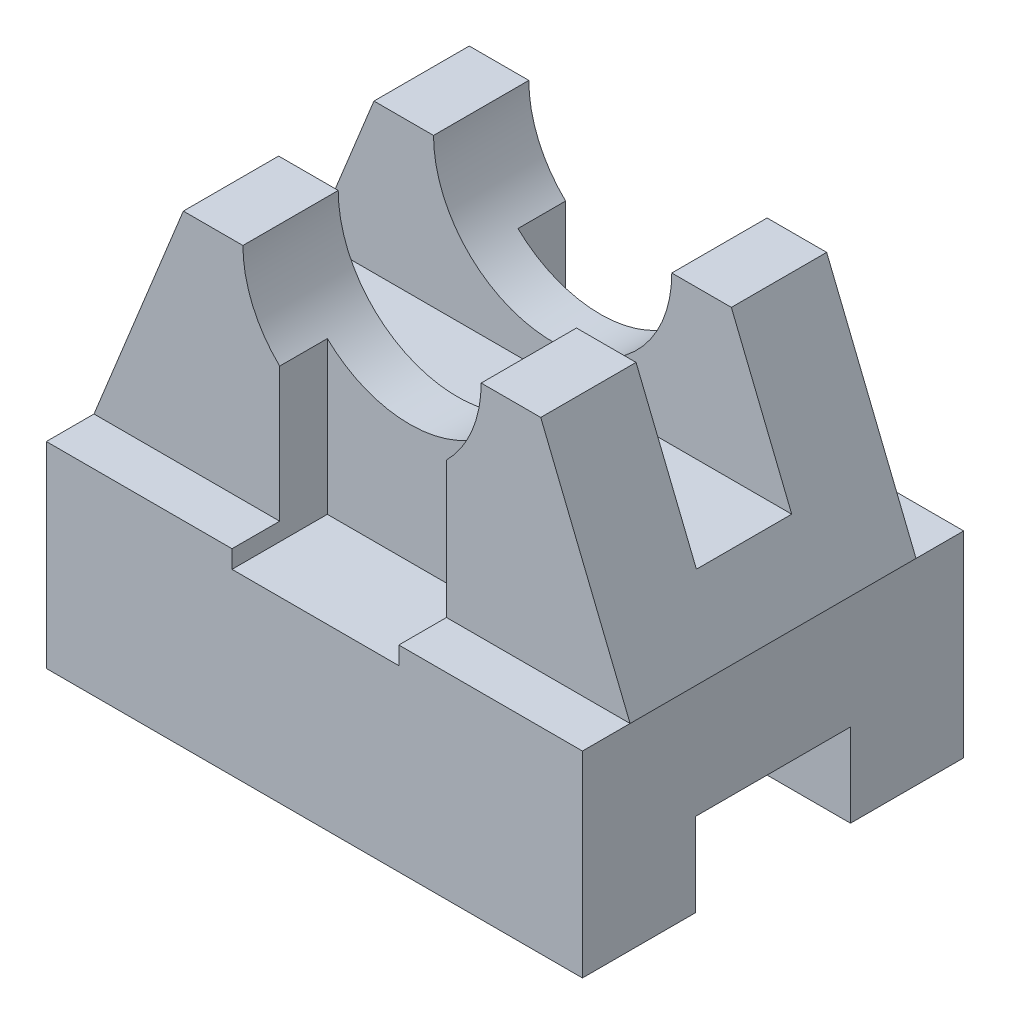
from build123d import *

# Parameters (mm, degrees)
SKETCH1_W           = 90
SKETCH1_H           = 64
BOSS_EXTRUDE1_DEPTH = 33
SKETCH2_W           = 26
SKETCH2_H           = 14
CUT_EXTRUDE1_DEPTH  = 102.05938848
BOSS_EXTRUDE2_DEPTH = 24
SKETCH4_W           = 86.893013234
SKETCH4_H           = 16
CUT_EXTRUDE2_DEPTH  = 25
SKETCH6_W           = 28
SKETCH6_H           = 16
CUT_EXTRUDE3_DEPTH  = 40


with BuildPart() as part:
    # Sketch1 → Boss-Extrude1 (new body)
    with BuildSketch(Plane(origin=(0, 0, 0), x_dir=(1, 0, 0), z_dir=(0, 1, 0))):
        Rectangle(SKETCH1_W, SKETCH1_H)
    extrude(amount=BOSS_EXTRUDE1_DEPTH)

    # Sketch2 → Cut-Extrude1 (cut, through all)
    with BuildSketch(Plane(origin=(45, 0, 0), x_dir=(0, 0, -1), z_dir=(1, 0, 0))):
        with Locations((0, 7)):
            Rectangle(SKETCH2_W, SKETCH2_H)
    extrude(amount=-CUT_EXTRUDE1_DEPTH, mode=Mode.SUBTRACT)

    # Sketch3 → Boss-Extrude2 (add, symmetric)
    with BuildSketch(Plane.XY):
        with BuildLine():
            Line((0, 50), (0, 33))
            Line((0, 33), (45, 33))
            Line((45, 33), (30, 70))
            Line((30, 70), (20, 70))
            ThreePointArc((20, 70), (14.142135624, 55.857864376), (0, 50))
        make_face()
    boss_extrude2 = extrude(amount=BOSS_EXTRUDE2_DEPTH, both=True)

    # Mirror2: Boss-Extrude2 across plane
    add(boss_extrude2.mirror(Plane(origin=(0, 0, 0), x_dir=(0, 0, 1), z_dir=(1, 0, 0))))

    # Sketch4 → Cut-Extrude2 (cut)
    with BuildSketch(Plane(origin=(0, 70, 0), x_dir=(1, 0, 0), z_dir=(0, 1, 0))):
        Rectangle(SKETCH4_W, SKETCH4_H)
    extrude(amount=-CUT_EXTRUDE2_DEPTH, mode=Mode.SUBTRACT)

    # Sketch6 → Cut-Extrude3 (cut)
    with BuildSketch(Plane(origin=(0, 70, 0), x_dir=(1, 0, 0), z_dir=(0, 1, 0))):
        with Locations((0.173717363, -24)):
            Rectangle(SKETCH6_W, SKETCH6_H)
    cut_extrude3 = extrude(amount=-CUT_EXTRUDE3_DEPTH, mode=Mode.SUBTRACT)

    # Mirror3: Cut-Extrude3 across plane
    add(cut_extrude3.mirror(Plane.XY), mode=Mode.SUBTRACT)


solid = part.part
